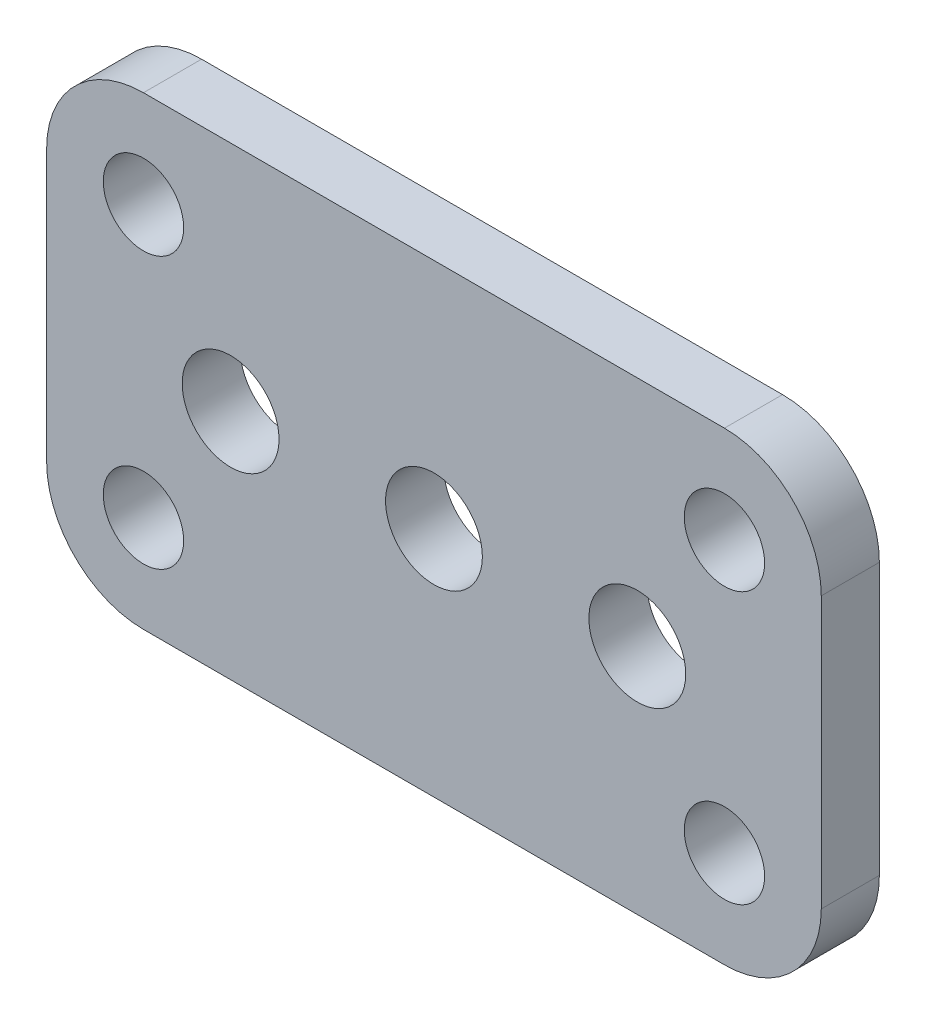
from build123d import *

# Parameters (mm, degrees)
ESQUISSE1_R        = 2.5
ESQUISSE1_R_2      = 2.075
BOSS_EXTRU_1_DEPTH = 3


with BuildPart() as part:
    # Esquisse1 → Boss.-Extru.1 (new body)
    with BuildSketch(Plane.XY):
        with BuildLine():
            Line((20, -7), (20, 7))
            ThreePointArc((20, 7), (18.535533906, 10.535533906), (15, 12))
            Line((15, 12), (-14.999999553, 12))
            ThreePointArc((-14.999999553, 12), (-18.535533459, 10.535533906), (-20, 7))
            Line((-20, 7), (-20, -7))
            ThreePointArc((-20, -7), (-18.535533775, -10.535534222), (-14.999999553, -12))
            Line((-14.999999553, -12), (15, -12))
            ThreePointArc((15, -12), (18.535533906, -10.535533906), (20, -7))
        make_face()
        Circle(ESQUISSE1_R, mode=Mode.SUBTRACT)
        with Locations((-10.5, 0)):
            Circle(ESQUISSE1_R, mode=Mode.SUBTRACT)
        with Locations((10.5, 0)):
            Circle(ESQUISSE1_R, mode=Mode.SUBTRACT)
        with Locations((-14.999999553, 7)):
            Circle(ESQUISSE1_R_2, mode=Mode.SUBTRACT)
        with Locations((15, 7)):
            Circle(ESQUISSE1_R_2, mode=Mode.SUBTRACT)
        with Locations((15, -7)):
            Circle(ESQUISSE1_R_2, mode=Mode.SUBTRACT)
        with Locations((-14.999999553, -7)):
            Circle(ESQUISSE1_R_2, mode=Mode.SUBTRACT)
    extrude(amount=BOSS_EXTRU_1_DEPTH)


solid = part.part
